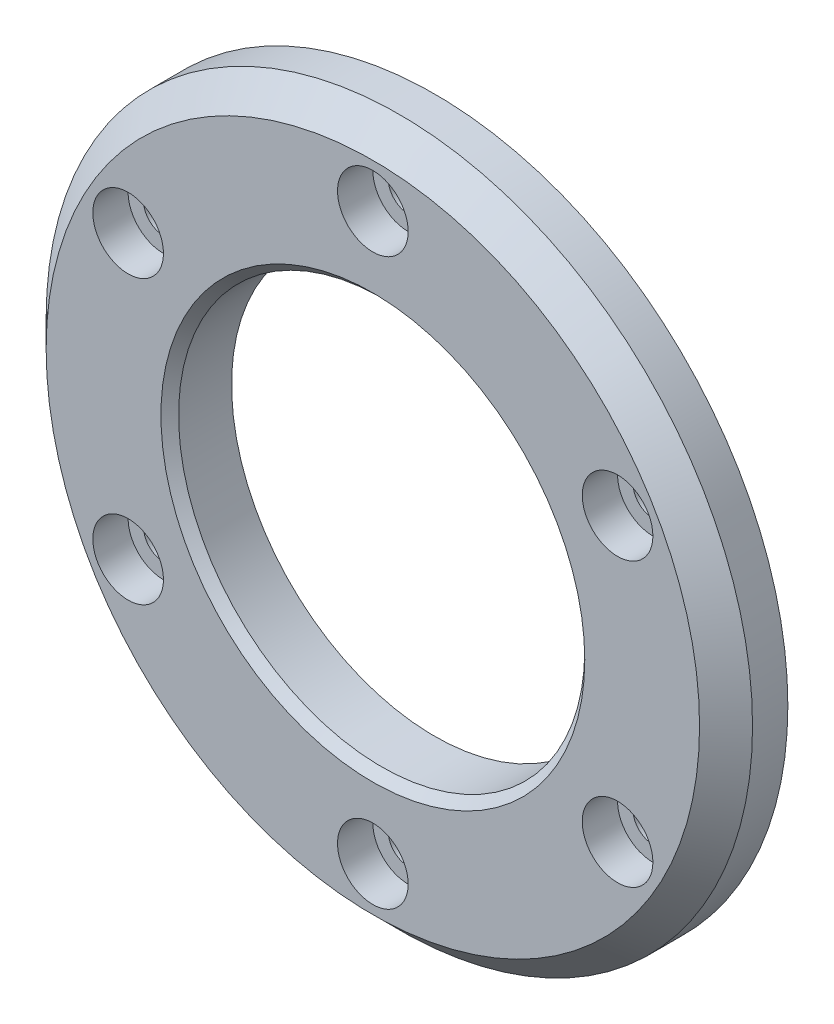
from build123d import *

# Parameters (mm, degrees)
SKETCH_2_R      = 40
SKETCH_2_R_2    = 2.25
SKETCH_2_R_3    = 23
EXTRUDE_1_DEPTH = 3
SKETCH_3_R      = 40
SKETCH_3_R_2    = 4
SKETCH_3_R_3    = 23
EXTRUDE_2_DEPTH = 4
CHAMFER_1_SIZE  = 3
CHAMFER_2_SIZE  = 1


with BuildPart() as part:
    # ｽｹｯﾁ2 → ﾎﾞｽ - 押し出し1 (new body)
    with BuildSketch(Plane.XY):
        Circle(SKETCH_2_R)
        with Locations((0, 32)):
            Circle(SKETCH_2_R_2, mode=Mode.SUBTRACT)
        Circle(SKETCH_2_R_3, mode=Mode.SUBTRACT)
        with Locations((-27.712812921, 16)):
            Circle(SKETCH_2_R_2, mode=Mode.SUBTRACT)
        with Locations((-27.712812921, -16)):
            Circle(SKETCH_2_R_2, mode=Mode.SUBTRACT)
        with Locations((0, -32)):
            Circle(SKETCH_2_R_2, mode=Mode.SUBTRACT)
        with Locations((27.712812921, -16)):
            Circle(SKETCH_2_R_2, mode=Mode.SUBTRACT)
        with Locations((27.712812921, 16)):
            Circle(SKETCH_2_R_2, mode=Mode.SUBTRACT)
    extrude(amount=EXTRUDE_1_DEPTH)

    # ｽｹｯﾁ3 → ﾎﾞｽ - 押し出し2 (add)
    with BuildSketch(Plane.XY.offset(3)):
        Circle(SKETCH_3_R)
        with Locations((0, 32)):
            Circle(SKETCH_3_R_2, mode=Mode.SUBTRACT)
        with Locations((-27.712812921, 16)):
            Circle(SKETCH_3_R_2, mode=Mode.SUBTRACT)
        with Locations((-27.712812921, -16)):
            Circle(SKETCH_3_R_2, mode=Mode.SUBTRACT)
        with Locations((0, -32)):
            Circle(SKETCH_3_R_2, mode=Mode.SUBTRACT)
        with Locations((27.712812921, -16)):
            Circle(SKETCH_3_R_2, mode=Mode.SUBTRACT)
        with Locations((27.712812921, 16)):
            Circle(SKETCH_3_R_2, mode=Mode.SUBTRACT)
        Circle(SKETCH_3_R_3, mode=Mode.SUBTRACT)
    extrude(amount=EXTRUDE_2_DEPTH)

    # 面取り1
    chamfer_1_edges = [part.edges().sort_by_distance(p)[0] for p in [
        (-40, 0, 7),
    ]]
    chamfer(chamfer_1_edges, length=CHAMFER_1_SIZE)

    # 面取り2
    chamfer_2_edges = [part.edges().sort_by_distance(p)[0] for p in [
        (-23, 0, 7),
    ]]
    chamfer(chamfer_2_edges, length=CHAMFER_2_SIZE)


solid = part.part
